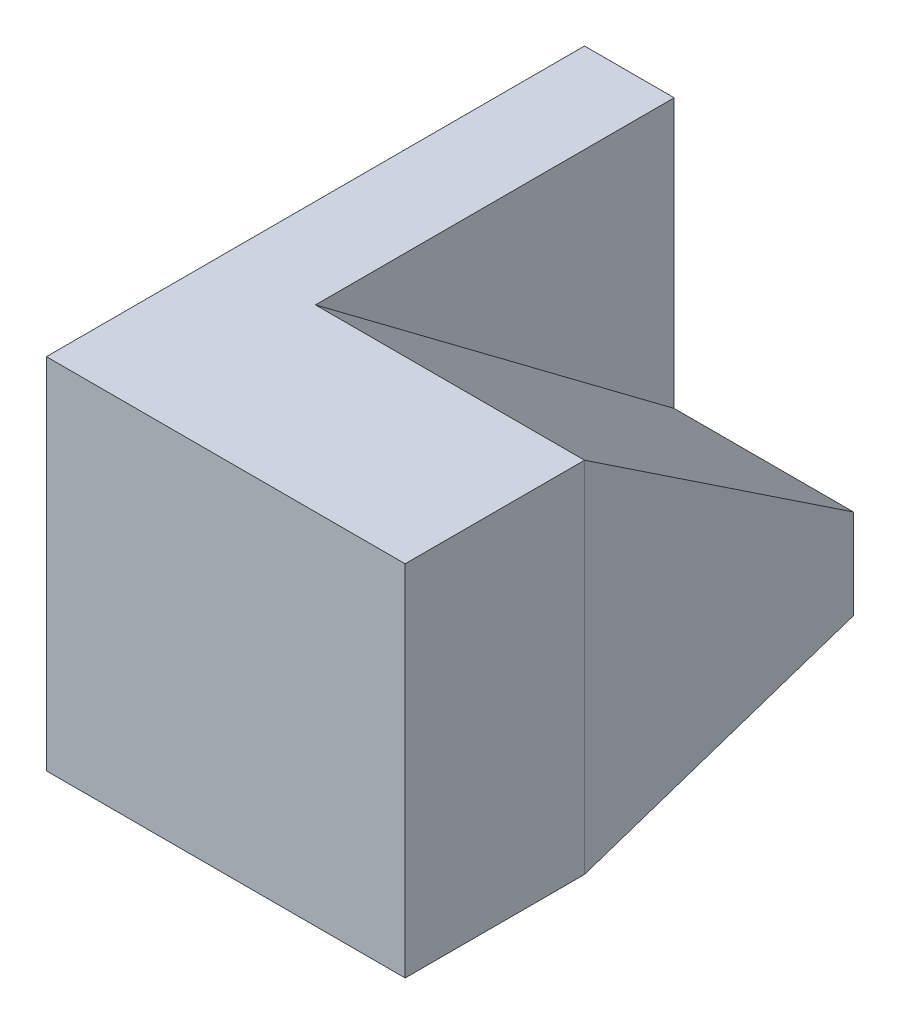
from build123d import *

# Parameters (mm, degrees)
SKETCH_2_W          = 60
SKETCH_2_H          = 40
EXTRUDE_1_DEPTH     = 40
CUT_EXTRUDE_1_DEPTH = 40
EXTRUDE_2_REACH     = 84.462
SKETCH_7_W          = 10
SKETCH_7_H          = 40


with BuildPart() as part:
    # 草圖2 → 填料-伸長1 (new body)
    with BuildSketch(Plane(origin=(0, 0, 0), x_dir=(0, 0, -1), z_dir=(1, 0, 0))):
        with Locations((-30, -20)):
            Rectangle(SKETCH_2_W, SKETCH_2_H)
    extrude(amount=EXTRUDE_1_DEPTH)

    # 草圖3 → 除料-伸長1 (cut)
    with BuildSketch(Plane(origin=(0, 0, 0), x_dir=(1, 0, 0), z_dir=(0, 1, 0))):
        Polygon((30, 0), (40, -40), (40, 0), align=None)
    extrude(amount=-CUT_EXTRUDE_1_DEPTH, mode=Mode.SUBTRACT)

    # 除料-掃出1: sweep along a path in 草圖6
    with BuildLine(Plane(origin=(28.235294118, 0, -7.058823529), x_dir=(-0.24253562503633305, 0, -0.9701425001453319), z_dir=(0.9701425001453319, 0, -0.24253562503633305))) as sweep_1_path:
        Line((-48.507125007, 0), (-7.276068751, -30))
    # 草圖5 → 除料-掃出1 (sweep, cut)
    with BuildSketch(Plane(origin=(0, 0, 0), x_dir=(1, 0, 0), z_dir=(0, 1, 0))):
        Polygon((30, 0), (10, 0), (10, -40), (40, -40), align=None)
    sweep(path=sweep_1_path.line, mode=Mode.SUBTRACT)

    # 填料-伸長2: up to this face of the body (flat: up to its plane)
    extrude_2_end = Plane(part.part.faces().sort_by_distance((20, -15, 20))[0])
    # 草圖7 → 填料-伸長2 (add, up to the picked face)
    with BuildSketch(Plane(origin=(0, 0, 0), x_dir=(1, 0, 0), z_dir=(0, 1, 0)), mode=Mode.PRIVATE) as extrude_2_sk1:
        with Locations((5, -20)):
            Rectangle(SKETCH_7_W, SKETCH_7_H)
    extrude_2_tool1 = split(extrude(extrude_2_sk1.sketch, amount=-EXTRUDE_2_REACH, mode=Mode.PRIVATE), bisect_by=extrude_2_end, keep=Keep.BOTH, mode=Mode.PRIVATE)
    add(extrude_2_tool1.solids().sort_by(Axis((5, 0, 20), (0, -1, 0)))[0])


solid = part.part
